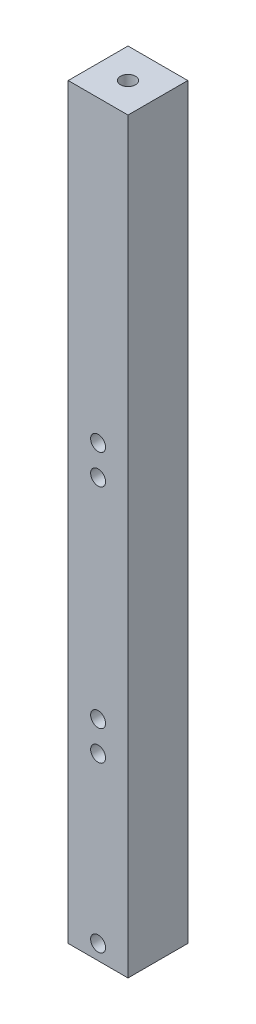
from build123d import *

# Parameters (mm, degrees)
SKETCH1_W           = 20
SKETCH1_H           = 20
SKETCH1_R           = 2.5
BOSS_EXTRUDE1_DEPTH = 250
SKETCH2_R           = 2.5
CUT_EXTRUDE1_DEPTH  = 100
SKETCH3_R           = 2.5
CUT_EXTRUDE2_DEPTH  = 251.99800796


with BuildPart() as part:
    # Sketch1 → Boss-Extrude1 (new body)
    with BuildSketch(Plane(origin=(0, 0, 0), x_dir=(1, 0, 0), z_dir=(0, 1, 0))):
        Rectangle(SKETCH1_W, SKETCH1_H)
        with Locations(Location((0, 0, 0), (0, 0, 270))):
            Circle(SKETCH1_R, mode=Mode.SUBTRACT)
    extrude(amount=BOSS_EXTRUDE1_DEPTH)

    # Sketch2 → Cut-Extrude1 (cut)
    with BuildSketch(Plane.XY.offset(10)):
        with Locations((0, 5)):
            Circle(SKETCH2_R)
    extrude(amount=-CUT_EXTRUDE1_DEPTH, mode=Mode.SUBTRACT)

    # Sketch3 → Cut-Extrude2 (cut, through all)
    with BuildSketch(Plane.XY.offset(10)):
        with Locations((0, 60)):
            Circle(SKETCH3_R)
        with Locations((0, 140)):
            Circle(SKETCH3_R)
        with Locations((0, 70)):
            Circle(SKETCH3_R)
        with Locations((0, 150)):
            Circle(SKETCH3_R)
    extrude(amount=-CUT_EXTRUDE2_DEPTH, mode=Mode.SUBTRACT)


solid = part.part
